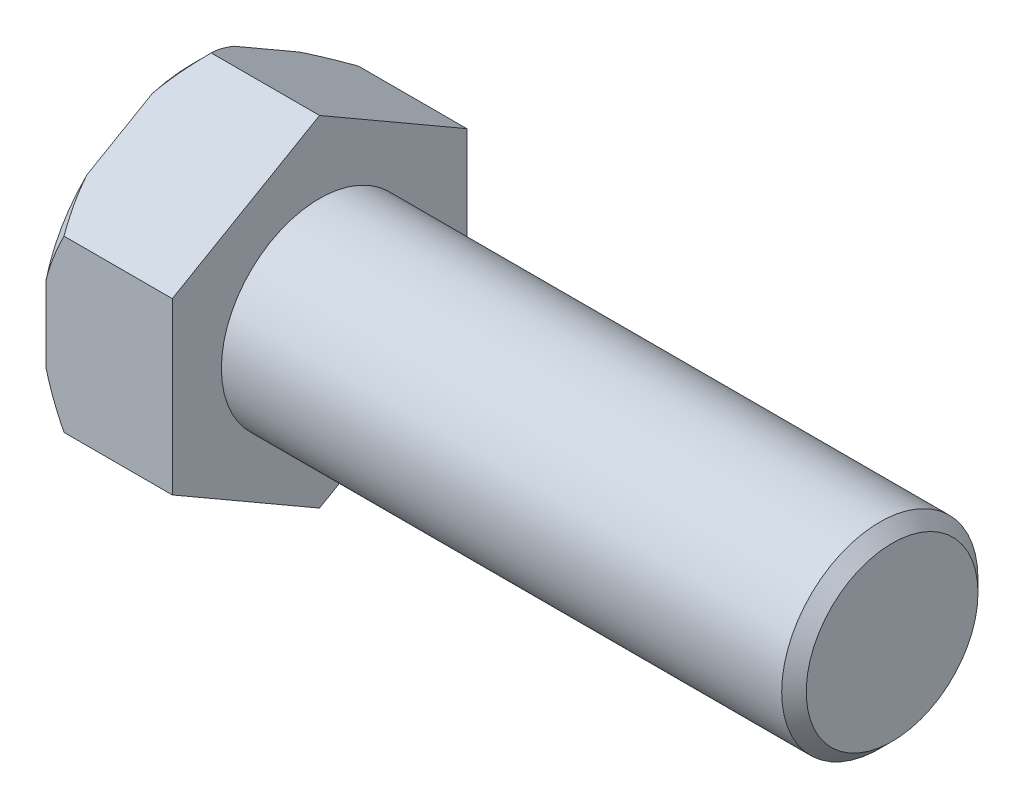
from build123d import *

# Parameters (mm, degrees)
EXTRUDE1_DEPTH     = 15.44
SKETCH3_R          = 12
EXTRUDE2_DEPTH     = 70
CHAMFER1_SIZE      = 1.5
CUT_EXTRUDE1_DEPTH = 0.01


with BuildPart() as part:
    # Sketch1 → Extrude1 (new body)
    with BuildSketch(Plane(origin=(0, 0, 0), x_dir=(0, 0, -1), z_dir=(1, 0, 0))):
        Polygon((0, 20.785), (-18.000338018, 10.3925), (-18.000338018, -10.3925), (0, -20.785), (18.000338018, -10.3925), (18.000338018, 10.3925), align=None)
    extrude(amount=EXTRUDE1_DEPTH)

    # Sketch2 → Cut-Revolve1 (revolve, cut)
    with BuildSketch(Plane.XY):
        Polygon((2.2, 20.785), (0, 18.585), (0, 20.785), align=None)
    revolve(axis=Axis((0, 0, 0), (1, 0, 0)), mode=Mode.SUBTRACT)

    # Sketch3 → Extrude2 (add)
    with BuildSketch(Plane(origin=(15.44, 0, 0), x_dir=(0, 0, -1), z_dir=(1, 0, 0))):
        Circle(SKETCH3_R)
    extrude(amount=EXTRUDE2_DEPTH)

    # Chamfer1
    chamfer1_edges = [part.edges().sort_by_distance(p)[0] for p in [
        (85.44, 0, 12),
    ]]
    chamfer(chamfer1_edges, length=CHAMFER1_SIZE)

    # Sketch4 → Cut-Extrude1 (cut)
    # profile 1 of 3: a face of its own
    with BuildSketch(Plane.ZY):
        with BuildLine():
            add(Edge.make_bspline(
                [(-1.076221955, -3.721907739), (-1.055758707, -3.732577708), (-1.01584854, -3.75338771), (-0.959007677, -3.786895444), (-0.907061247, -3.822210419), (-0.858567989, -3.857664604), (-0.814379881, -3.894615784), (-0.774991015, -3.933210895), (-0.739428429, -3.972486571), (-0.708409298, -4.013107885), (-0.681125843, -4.05496692), (-0.657545746, -4.098173544), (-0.637390601, -4.142633068), (-0.621417074, -4.188830803), (-0.608258651, -4.236088133), (-0.599204647, -4.285015263), (-0.59433542, -4.335289792), (-0.593414839, -4.369267151), (-0.592948718, -4.386471041)],
                knots=[0, 0, 0, 0, 1.272397273, 2.481599622, 3.635517121, 4.734568067, 5.792894095, 6.808321871, 7.773003508, 8.711915296, 9.623354172, 10.525449501, 11.423591555, 12.311487226, 13.218079475, 14.126165749, 15.051214107, 16, 16, 16, 16], degree=3))
            add(Edge.make_bspline(
                [(-0.592948718, -4.386471041), (-0.593499733, -4.41054085), (-0.594590397, -4.458184033), (-0.604090386, -4.528502684), (-0.618313942, -4.596796814), (-0.639085022, -4.66305145), (-0.666023159, -4.726901003), (-0.699220899, -4.788400127), (-0.736800331, -4.848556776), (-0.766980502, -4.885570634), (-0.782251603, -4.904299566)],
                knots=[0, 0, 0, 0, 1.025265484, 2.029385089, 3.018602448, 3.995076438, 4.983346944, 5.966715145, 6.97116228, 8, 8, 8, 8], degree=3))
            add(Edge.make_bspline(
                [(-0.782251603, -4.904299566), (-0.802134798, -4.926152262), (-0.841655488, -4.969587614), (-0.909357579, -5.02598105), (-0.983658925, -5.073373474), (-1.06427202, -5.111996256), (-1.150981378, -5.142057584), (-1.243768524, -5.163659382), (-1.342814347, -5.176032546), (-1.410889684, -5.17782111), (-1.445813301, -5.178738669)],
                knots=[0, 0, 0, 0, 0.954267603, 1.896743057, 2.838368354, 3.796610408, 4.779680527, 5.799409237, 6.871065594, 8, 8, 8, 8], degree=3))
            add(Edge.make_bspline(
                [(-1.445813301, -5.178738669), (-1.479394293, -5.17791547), (-1.544739492, -5.176313609), (-1.639852262, -5.165460444), (-1.728511598, -5.146440539), (-1.811233004, -5.120408676), (-1.887517785, -5.086544227), (-1.957148571, -5.044395363), (-2.02112998, -4.995658619), (-2.077520318, -4.938934277), (-2.127583492, -4.878178654), (-2.171560673, -4.815498933), (-2.208113586, -4.750889392), (-2.239061512, -4.685313415), (-2.262752956, -4.617851877), (-2.279161678, -4.548851867), (-2.289582617, -4.478433908), (-2.290969142, -4.430911299), (-2.291666667, -4.407003893)],
                knots=[0, 0, 0, 0, 1.256902934, 2.445805442, 3.576955095, 4.645999104, 5.686449165, 6.692658513, 7.68621702, 8.689161843, 9.678783111, 10.630372946, 11.551080876, 12.453998257, 13.34127905, 14.221779781, 15.105423033, 16, 16, 16, 16], degree=3))
            add(Edge.make_bspline(
                [(-2.291666667, -4.407003893), (-2.291253895, -4.389461613), (-2.290438111, -4.354791876), (-2.284791791, -4.303570927), (-2.275714318, -4.253716545), (-2.263386135, -4.205044586), (-2.246678259, -4.157909391), (-2.226505307, -4.112087624), (-2.202982484, -4.067527553), (-2.175781651, -4.023985495), (-2.144137349, -3.982071558), (-2.10830617, -3.941074419), (-2.067571978, -3.901630228), (-2.022387936, -3.863257068), (-1.973270408, -3.825274229), (-1.9189436, -3.789734423), (-1.860847695, -3.754121591), (-1.819558119, -3.73282993), (-1.798377404, -3.721907739)],
                knots=[0, 0, 0, 0, 0.941657376, 1.861047343, 2.762797495, 3.66048619, 4.553285746, 5.444104102, 6.34607688, 7.256116206, 8.197091036, 9.162375105, 10.176350973, 11.237807142, 12.343728897, 13.50695164, 14.721116704, 16, 16, 16, 16], degree=3))
            add(Edge.make_bspline(
                [(-1.798377404, -3.721907739), (-1.827371243, -3.70609719), (-1.883511431, -3.675483542), (-1.957846746, -3.619235823), (-2.021697191, -3.558315956), (-2.073307704, -3.491437531), (-2.113930724, -3.420689763), (-2.141801156, -3.346515297), (-2.160655787, -3.270289502), (-2.162523521, -3.218213647), (-2.163461538, -3.192059983)],
                knots=[0, 0, 0, 0, 1.166880483, 2.259407225, 3.286803203, 4.280235371, 5.237608625, 6.161067461, 7.076446754, 8, 8, 8, 8], degree=3))
            add(Edge.make_bspline(
                [(-2.163461538, -3.192059983), (-2.162293378, -3.16541887), (-2.159945173, -3.111865586), (-2.140957087, -3.032146927), (-2.110014182, -2.95384938), (-2.067927756, -2.877352443), (-2.015508316, -2.805245146), (-1.952617926, -2.740573042), (-1.880758428, -2.683921983), (-1.800288523, -2.636367574), (-1.713691212, -2.59766496), (-1.622322838, -2.570966087), (-1.527775342, -2.553511718), (-1.463419829, -2.551535536), (-1.430789263, -2.550533541)],
                knots=[0, 0, 0, 0, 0.888701115, 1.786444228, 2.72001202, 3.692817113, 4.693886446, 5.687152267, 6.695133018, 7.739871481, 8.800368666, 9.853104506, 10.91144658, 12, 12, 12, 12], degree=3))
            add(Edge.make_bspline(
                [(-1.430789263, -2.550533541), (-1.399000824, -2.551566643), (-1.336317643, -2.553603803), (-1.244178623, -2.57059443), (-1.156017996, -2.598972658), (-1.072139783, -2.637470675), (-0.994045592, -2.684889918), (-0.925043942, -2.742319114), (-0.864092098, -2.806705936), (-0.813674674, -2.878791367), (-0.772129752, -2.954994362), (-0.743200537, -3.034724735), (-0.724663413, -3.116259777), (-0.722325296, -3.171429779), (-0.721153846, -3.199071201)],
                knots=[0, 0, 0, 0, 1.072916533, 2.115669174, 3.151510826, 4.193348718, 5.225979165, 6.227137561, 7.216255879, 8.211077061, 9.189680878, 10.138522389, 11.067357538, 12, 12, 12, 12], degree=3))
            add(Edge.make_bspline(
                [(-0.721153846, -3.199071201), (-0.722178532, -3.226197389), (-0.724190958, -3.279471682), (-0.741119486, -3.357133482), (-0.769628996, -3.42986351), (-0.808553398, -3.498487047), (-0.859285889, -3.561759545), (-0.92114927, -3.620485595), (-0.993650325, -3.675147616), (-1.048122387, -3.705995019), (-1.076221955, -3.721907739)],
                knots=[0, 0, 0, 0, 0.975232327, 1.915300861, 2.843280834, 3.77672583, 4.742871857, 5.749627742, 6.839139064, 8, 8, 8, 8], degree=3))
        make_face()
        with BuildLine():
            add(Edge.make_bspline(
                [(-1.443309295, -2.806943797), (-1.460845585, -2.807409112), (-1.495154236, -2.808319471), (-1.545460429, -2.81307564), (-1.593297834, -2.822327938), (-1.639166264, -2.834641303), (-1.682436844, -2.85127558), (-1.72369724, -2.870843444), (-1.762245233, -2.894633491), (-1.798546163, -2.921320061), (-1.831225288, -2.950672137), (-1.860228539, -2.981253364), (-1.884320049, -3.013664359), (-1.904777985, -3.047098901), (-1.919621926, -3.082549313), (-1.930739285, -3.118928725), (-1.938254565, -3.156696856), (-1.938817701, -3.182508649), (-1.939102564, -3.195565592)],
                knots=[0, 0, 0, 0, 1.203892937, 2.355340988, 3.463153438, 4.544400666, 5.610487187, 6.640501085, 7.674077295, 8.714426146, 9.728707835, 10.68524104, 11.601827946, 12.495867327, 13.368432065, 14.231010473, 15.105153427, 16, 16, 16, 16], degree=3))
            add(Edge.make_bspline(
                [(-1.939102564, -3.195565592), (-1.938611588, -3.208623099), (-1.937641348, -3.234426608), (-1.930137685, -3.272530798), (-1.918954217, -3.309974824), (-1.901346602, -3.345868332), (-1.880227775, -3.381456446), (-1.854162435, -3.415849721), (-1.823098843, -3.449167854), (-1.788079243, -3.481127454), (-1.749928145, -3.511055142), (-1.709510971, -3.537035986), (-1.667334977, -3.558774637), (-1.623833499, -3.576867069), (-1.578563179, -3.59093131), (-1.531801413, -3.600908914), (-1.48354034, -3.60711034), (-1.450839925, -3.60785107), (-1.434294872, -3.608225848)],
                knots=[0, 0, 0, 0, 0.873023192, 1.725219244, 2.590779336, 3.480155217, 4.391973325, 5.357036234, 6.360879153, 7.436073238, 8.526419356, 9.601555421, 10.645666583, 11.697338044, 12.750135903, 13.812665442, 14.89329948, 16, 16, 16, 16], degree=3))
            add(Edge.make_bspline(
                [(-1.434294872, -3.608225848), (-1.413044798, -3.607602372), (-1.370754535, -3.606361577), (-1.308412155, -3.594825024), (-1.247795981, -3.57667794), (-1.189553906, -3.551849393), (-1.135193488, -3.520686636), (-1.086736297, -3.483377337), (-1.044595659, -3.440782982), (-1.009209509, -3.393566671), (-0.981773904, -3.343315536), (-0.96041547, -3.292886755), (-0.947943173, -3.241742305), (-0.94631634, -3.207480188), (-0.945512821, -3.190557579)],
                knots=[0, 0, 0, 0, 1.076279235, 2.141928126, 3.20205304, 4.278698113, 5.344010996, 6.36967002, 7.368914609, 8.37248503, 9.349703398, 10.264243087, 11.142681841, 12, 12, 12, 12], degree=3))
            add(Edge.make_bspline(
                [(-0.945512821, -3.190557579), (-0.945892747, -3.178680411), (-0.946646848, -3.155105933), (-0.952861173, -3.120292815), (-0.963129626, -3.086271684), (-0.977031826, -3.052761491), (-0.995324536, -3.020232397), (-1.017013241, -2.988173048), (-1.043359314, -2.957304645), (-1.072928195, -2.926907825), (-1.10646063, -2.898776379), (-1.143891996, -2.874037301), (-1.185030389, -2.853028475), (-1.229876782, -2.835965078), (-1.278266013, -2.823149114), (-1.329975209, -2.813551723), (-1.385435528, -2.808142358), (-1.423599636, -2.807351982), (-1.443309295, -2.806943797)],
                knots=[0, 0, 0, 0, 0.814439003, 1.616544685, 2.417341072, 3.248991801, 4.09997495, 4.973547432, 5.9003056, 6.880240646, 7.880314356, 8.896779544, 9.951930927, 11.043077905, 12.18215768, 13.381699519, 14.647792085, 16, 16, 16, 16], degree=3))
        make_face(mode=Mode.SUBTRACT)
        with BuildLine():
            add(Edge.make_bspline(
                [(-1.428786058, -3.864636105), (-1.451018762, -3.865031563), (-1.494633902, -3.865807355), (-1.558531708, -3.874442713), (-1.619855397, -3.886463708), (-1.678398209, -3.904700021), (-1.734135421, -3.9284118), (-1.787368766, -3.956936471), (-1.837691001, -3.990654645), (-1.884407234, -4.029137941), (-1.927066755, -4.07060898), (-1.964494113, -4.114510505), (-1.996278056, -4.1600266), (-2.021873235, -4.207735335), (-2.042881615, -4.256626486), (-2.056677242, -4.307917625), (-2.065521321, -4.360622706), (-2.066708915, -4.396451348), (-2.067307692, -4.414515912)],
                knots=[0, 0, 0, 0, 1.140299081, 2.23698856, 3.303958914, 4.344563908, 5.37730929, 6.408454204, 7.439741482, 8.480804886, 9.510774543, 10.48932336, 11.43758569, 12.353841022, 13.263987381, 14.161954604, 15.073269652, 16, 16, 16, 16], degree=3))
            add(Edge.make_bspline(
                [(-2.067307692, -4.414515912), (-2.066333936, -4.43696656), (-2.064402026, -4.481508119), (-2.049075856, -4.547338884), (-2.024479045, -4.611068209), (-1.990175319, -4.672176747), (-1.947698481, -4.729283966), (-1.89546529, -4.779061663), (-1.836721835, -4.82329129), (-1.76948051, -4.8590631), (-1.696031606, -4.887630853), (-1.616394657, -4.907313684), (-1.531712572, -4.920343291), (-1.473241435, -4.921656277), (-1.443309295, -4.922328412)],
                knots=[0, 0, 0, 0, 0.898778495, 1.783155532, 2.693654817, 3.627872908, 4.583023416, 5.533784346, 6.509005473, 7.520592997, 8.575161974, 9.658835044, 10.801527049, 12, 12, 12, 12], degree=3))
            add(Edge.make_bspline(
                [(-1.443309295, -4.922328412), (-1.419916175, -4.921879263), (-1.374338876, -4.921004177), (-1.307848912, -4.913279682), (-1.245102806, -4.90102995), (-1.186222236, -4.883213131), (-1.130548064, -4.861463148), (-1.07902424, -4.83348309), (-1.030325292, -4.801660002), (-0.986850919, -4.763904176), (-0.94725577, -4.723561679), (-0.912731989, -4.680854506), (-0.88276231, -4.63694334), (-0.859240199, -4.590835851), (-0.840435732, -4.543416626), (-0.826918907, -4.494248404), (-0.818578753, -4.44318038), (-0.817735256, -4.408538187), (-0.817307692, -4.390978252)],
                knots=[0, 0, 0, 0, 1.224942928, 2.386581632, 3.501229538, 4.569074225, 5.605009692, 6.626002462, 7.634866581, 8.645888296, 9.63523824, 10.59253846, 11.518950513, 12.414518923, 13.29783783, 14.186679152, 15.080837789, 16, 16, 16, 16], degree=3))
            add(Edge.make_bspline(
                [(-0.817307692, -4.390978252), (-0.817954727, -4.373923009), (-0.819230566, -4.340293048), (-0.827328203, -4.290459815), (-0.84155383, -4.242314948), (-0.861073399, -4.195279229), (-0.887059801, -4.150305693), (-0.917663279, -4.106222713), (-0.95458765, -4.064253824), (-0.996310933, -4.024073042), (-1.041781619, -3.986918944), (-1.090115294, -3.954051488), (-1.140939909, -3.926371405), (-1.194147917, -3.903859622), (-1.249621172, -3.886154287), (-1.30731887, -3.873785719), (-1.367308567, -3.866000288), (-1.408062046, -3.86509597), (-1.428786058, -3.864636105)],
                knots=[0, 0, 0, 0, 0.917430815, 1.809013306, 2.70690318, 3.612392954, 4.541220862, 5.495268465, 6.494511384, 7.542276156, 8.608045339, 9.649016899, 10.681629292, 11.715607085, 12.752076957, 13.808767841, 14.885711793, 16, 16, 16, 16], degree=3))
        make_face(mode=Mode.SUBTRACT)
    # profile 2 of 3: a face of its own
    with BuildSketch(Plane.ZY):
        with BuildLine():
            add(Edge.make_bspline(
                [(0.032051282, -4.73002072), (0.045972862, -4.730847982), (0.073264492, -4.732469732), (0.112721013, -4.743595928), (0.148431484, -4.763352114), (0.18024023, -4.78968267), (0.206459142, -4.821608143), (0.226919394, -4.857033793), (0.237948669, -4.896820644), (0.239558606, -4.924270412), (0.240384615, -4.938354053)],
                knots=[0, 0, 0, 0, 1.020151414, 1.999887582, 2.974338812, 3.990962822, 5.007586832, 5.987933904, 6.967670073, 8, 8, 8, 8], degree=3))
            add(Edge.make_bspline(
                [(0.240384615, -4.938354053), (0.239530615, -4.952099289), (0.237846538, -4.979204692), (0.226944675, -5.018691451), (0.206303211, -5.054139239), (0.180421073, -5.08649791), (0.148423621, -5.112884246), (0.112636587, -5.132472349), (0.073357117, -5.144395192), (0.045988315, -5.145913976), (0.032051282, -5.146687387)],
                knots=[0, 0, 0, 0, 1.009421747, 1.99056486, 2.972319754, 3.999869655, 5.017953583, 5.993804169, 6.978383603, 8, 8, 8, 8], degree=3))
            add(Edge.make_bspline(
                [(0.032051282, -5.146687387), (0.018104207, -5.14594196), (-0.009124138, -5.144486692), (-0.048256991, -5.132227545), (-0.084261969, -5.11306793), (-0.116253191, -5.086448709), (-0.1423521, -5.05430575), (-0.162084516, -5.018447324), (-0.173934622, -4.979317726), (-0.175493103, -4.952121552), (-0.176282051, -4.938354053)],
                knots=[0, 0, 0, 0, 1.022052826, 1.995314843, 2.982371812, 4.00089066, 5.028879526, 6.005146991, 6.990147033, 8, 8, 8, 8], degree=3))
            add(Edge.make_bspline(
                [(-0.176282051, -4.938354053), (-0.175523409, -4.924247354), (-0.174042253, -4.896705754), (-0.162059638, -4.85727782), (-0.142505201, -4.82144322), (-0.116072776, -4.789731377), (-0.084269708, -4.763169018), (-0.048343847, -4.743837023), (-0.00902989, -4.732379586), (0.018120066, -4.730820645), (0.032051282, -4.73002072)],
                knots=[0, 0, 0, 0, 1.032775665, 2.016367738, 2.991239715, 4.008302682, 5.025365648, 6.011011707, 6.979408107, 8, 8, 8, 8], degree=3))
        make_face()
    # profile 3 of 3: a face of its own
    with BuildSketch(Plane.ZY):
        with BuildLine():
            add(Edge.make_bspline(
                [(1.776342147, -3.721907739), (1.796805395, -3.732577708), (1.836715563, -3.75338771), (1.893556426, -3.786895444), (1.945502855, -3.822210419), (1.993996114, -3.857664604), (2.038184222, -3.894615784), (2.077573088, -3.933210895), (2.113135674, -3.972486571), (2.144154805, -4.013107885), (2.17143826, -4.05496692), (2.195018356, -4.098173544), (2.215173501, -4.142633068), (2.231147029, -4.188830803), (2.244305452, -4.236088133), (2.253359455, -4.285015263), (2.258228682, -4.335289792), (2.259149263, -4.369267151), (2.259615385, -4.386471041)],
                knots=[0, 0, 0, 0, 1.272397273, 2.481599622, 3.635517121, 4.734568067, 5.792894095, 6.808321871, 7.773003508, 8.711915296, 9.623354172, 10.525449501, 11.423591555, 12.311487226, 13.218079475, 14.126165749, 15.051214107, 16, 16, 16, 16], degree=3))
            add(Edge.make_bspline(
                [(2.259615385, -4.386471041), (2.25906437, -4.41054085), (2.257973705, -4.458184033), (2.248473717, -4.528502684), (2.234250161, -4.596796814), (2.21347908, -4.66305145), (2.186540944, -4.726901003), (2.153343204, -4.788400127), (2.115763772, -4.848556776), (2.085583601, -4.885570634), (2.0703125, -4.904299566)],
                knots=[0, 0, 0, 0, 1.025265484, 2.029385089, 3.018602448, 3.995076438, 4.983346944, 5.966715145, 6.97116228, 8, 8, 8, 8], degree=3))
            add(Edge.make_bspline(
                [(2.0703125, -4.904299566), (2.050429304, -4.926152262), (2.010908614, -4.969587614), (1.943206523, -5.02598105), (1.868905178, -5.073373474), (1.788292083, -5.111996256), (1.701582725, -5.142057584), (1.608795579, -5.163659382), (1.509749755, -5.176032546), (1.441674419, -5.17782111), (1.406750801, -5.178738669)],
                knots=[0, 0, 0, 0, 0.954267603, 1.896743057, 2.838368354, 3.796610408, 4.779680527, 5.799409237, 6.871065594, 8, 8, 8, 8], degree=3))
            add(Edge.make_bspline(
                [(1.406750801, -5.178738669), (1.373169809, -5.17791547), (1.30782461, -5.176313609), (1.21271184, -5.165460444), (1.124052505, -5.146440539), (1.041331099, -5.120408676), (0.965046318, -5.086544227), (0.895415531, -5.044395363), (0.831434123, -4.995658619), (0.775043784, -4.938934277), (0.72498061, -4.878178654), (0.681003429, -4.815498933), (0.644450516, -4.750889392), (0.613502591, -4.685313415), (0.589811146, -4.617851877), (0.573402425, -4.548851867), (0.562981486, -4.478433908), (0.561594961, -4.430911299), (0.560897436, -4.407003893)],
                knots=[0, 0, 0, 0, 1.256902934, 2.445805442, 3.576955095, 4.645999104, 5.686449165, 6.692658513, 7.68621702, 8.689161843, 9.678783111, 10.630372946, 11.551080876, 12.453998257, 13.34127905, 14.221779781, 15.105423033, 16, 16, 16, 16], degree=3))
            add(Edge.make_bspline(
                [(0.560897436, -4.407003893), (0.561310208, -4.389461613), (0.562125992, -4.354791876), (0.567772312, -4.303570927), (0.576849784, -4.253716545), (0.589177967, -4.205044586), (0.605885844, -4.157909391), (0.626058796, -4.112087624), (0.649581619, -4.067527553), (0.676782451, -4.023985495), (0.708426754, -3.982071558), (0.744257932, -3.941074419), (0.784992124, -3.901630228), (0.830176166, -3.863257068), (0.879293695, -3.825274229), (0.933620502, -3.789734423), (0.991716408, -3.754121591), (1.033005983, -3.73282993), (1.054186699, -3.721907739)],
                knots=[0, 0, 0, 0, 0.941657376, 1.861047343, 2.762797495, 3.66048619, 4.553285746, 5.444104102, 6.34607688, 7.256116206, 8.197091036, 9.162375105, 10.176350973, 11.237807142, 12.343728897, 13.50695164, 14.721116704, 16, 16, 16, 16], degree=3))
            add(Edge.make_bspline(
                [(1.054186699, -3.721907739), (1.02519286, -3.70609719), (0.969052672, -3.675483542), (0.894717357, -3.619235823), (0.830866911, -3.558315956), (0.779256399, -3.491437531), (0.738633379, -3.420689763), (0.710762947, -3.346515297), (0.691908316, -3.270289502), (0.690040582, -3.218213647), (0.689102564, -3.192059983)],
                knots=[0, 0, 0, 0, 1.166880483, 2.259407225, 3.286803203, 4.280235371, 5.237608625, 6.161067461, 7.076446754, 8, 8, 8, 8], degree=3))
            add(Edge.make_bspline(
                [(0.689102564, -3.192059983), (0.690270724, -3.16541887), (0.69261893, -3.111865586), (0.711607016, -3.032146927), (0.74254992, -2.95384938), (0.784636347, -2.877352443), (0.837055787, -2.805245146), (0.899946177, -2.740573042), (0.971805675, -2.683921983), (1.05227558, -2.636367574), (1.138872891, -2.59766496), (1.230241265, -2.570966087), (1.32478876, -2.553511718), (1.389144274, -2.551535536), (1.42177484, -2.550533541)],
                knots=[0, 0, 0, 0, 0.888701115, 1.786444228, 2.72001202, 3.692817113, 4.693886446, 5.687152267, 6.695133018, 7.739871481, 8.800368666, 9.853104506, 10.91144658, 12, 12, 12, 12], degree=3))
            add(Edge.make_bspline(
                [(1.42177484, -2.550533541), (1.453563279, -2.551566643), (1.51624646, -2.553603803), (1.60838548, -2.57059443), (1.696546106, -2.598972658), (1.78042432, -2.637470675), (1.858518511, -2.684889918), (1.92752016, -2.742319114), (1.988472005, -2.806705936), (2.038889429, -2.878791367), (2.08043435, -2.954994362), (2.109363565, -3.034724735), (2.127900689, -3.116259777), (2.130238807, -3.171429779), (2.131410256, -3.199071201)],
                knots=[0, 0, 0, 0, 1.072916533, 2.115669174, 3.151510826, 4.193348718, 5.225979165, 6.227137561, 7.216255879, 8.211077061, 9.189680878, 10.138522389, 11.067357538, 12, 12, 12, 12], degree=3))
            add(Edge.make_bspline(
                [(2.131410256, -3.199071201), (2.13038557, -3.226197389), (2.128373145, -3.279471682), (2.111444617, -3.357133482), (2.082935107, -3.42986351), (2.044010705, -3.498487047), (1.993278214, -3.561759545), (1.931414833, -3.620485595), (1.858913777, -3.675147616), (1.804441715, -3.705995019), (1.776342147, -3.721907739)],
                knots=[0, 0, 0, 0, 0.975232327, 1.915300861, 2.843280834, 3.77672583, 4.742871857, 5.749627742, 6.839139064, 8, 8, 8, 8], degree=3))
        make_face()
        with BuildLine():
            add(Edge.make_bspline(
                [(1.409254808, -2.806943797), (1.391718518, -2.807409112), (1.357409867, -2.808319471), (1.307103673, -2.81307564), (1.259266268, -2.822327938), (1.213397839, -2.834641303), (1.170127259, -2.85127558), (1.128866863, -2.870843444), (1.09031887, -2.894633491), (1.054017939, -2.921320061), (1.021338815, -2.950672137), (0.992335564, -2.981253364), (0.968244053, -3.013664359), (0.947786118, -3.047098901), (0.932942177, -3.082549313), (0.921824817, -3.118928725), (0.914309537, -3.156696856), (0.913746402, -3.182508649), (0.913461538, -3.195565592)],
                knots=[0, 0, 0, 0, 1.203892937, 2.355340988, 3.463153438, 4.544400666, 5.610487187, 6.640501085, 7.674077295, 8.714426146, 9.728707835, 10.68524104, 11.601827946, 12.495867327, 13.368432065, 14.231010473, 15.105153427, 16, 16, 16, 16], degree=3))
            add(Edge.make_bspline(
                [(0.913461538, -3.195565592), (0.913952515, -3.208623099), (0.914922755, -3.234426608), (0.922426418, -3.272530798), (0.933609885, -3.309974824), (0.951217501, -3.345868332), (0.972336328, -3.381456446), (0.998401668, -3.415849721), (1.029465259, -3.449167854), (1.06448486, -3.481127454), (1.102635958, -3.511055142), (1.143053132, -3.537035986), (1.185229126, -3.558774637), (1.228730604, -3.576867069), (1.274000923, -3.59093131), (1.32076269, -3.600908914), (1.369023763, -3.60711034), (1.401724178, -3.60785107), (1.418269231, -3.608225848)],
                knots=[0, 0, 0, 0, 0.873023192, 1.725219244, 2.590779336, 3.480155217, 4.391973325, 5.357036234, 6.360879153, 7.436073238, 8.526419356, 9.601555421, 10.645666583, 11.697338044, 12.750135903, 13.812665442, 14.89329948, 16, 16, 16, 16], degree=3))
            add(Edge.make_bspline(
                [(1.418269231, -3.608225848), (1.439519305, -3.607602372), (1.481809568, -3.606361577), (1.544151947, -3.594825024), (1.604768122, -3.57667794), (1.663010196, -3.551849393), (1.717370614, -3.520686636), (1.765827806, -3.483377337), (1.807968444, -3.440782982), (1.843354594, -3.393566671), (1.870790198, -3.343315536), (1.892148633, -3.292886755), (1.904620929, -3.241742305), (1.906247763, -3.207480188), (1.907051282, -3.190557579)],
                knots=[0, 0, 0, 0, 1.076279235, 2.141928126, 3.20205304, 4.278698113, 5.344010996, 6.36967002, 7.368914609, 8.37248503, 9.349703398, 10.264243087, 11.142681841, 12, 12, 12, 12], degree=3))
            add(Edge.make_bspline(
                [(1.907051282, -3.190557579), (1.906671355, -3.178680411), (1.905917255, -3.155105933), (1.899702929, -3.120292815), (1.889434477, -3.086271684), (1.875532277, -3.052761491), (1.857239566, -3.020232397), (1.835550861, -2.988173048), (1.809204789, -2.957304645), (1.779635908, -2.926907825), (1.746103473, -2.898776379), (1.708672107, -2.874037301), (1.667533714, -2.853028475), (1.622687321, -2.835965078), (1.57429809, -2.823149114), (1.522588894, -2.813551723), (1.467128574, -2.808142358), (1.428964466, -2.807351982), (1.409254808, -2.806943797)],
                knots=[0, 0, 0, 0, 0.814439003, 1.616544685, 2.417341072, 3.248991801, 4.09997495, 4.973547432, 5.9003056, 6.880240646, 7.880314356, 8.896779544, 9.951930927, 11.043077905, 12.18215768, 13.381699519, 14.647792085, 16, 16, 16, 16], degree=3))
        make_face(mode=Mode.SUBTRACT)
        with BuildLine():
            add(Edge.make_bspline(
                [(1.423778045, -3.864636105), (1.401545341, -3.865031563), (1.357930201, -3.865807355), (1.294032395, -3.874442713), (1.232708705, -3.886463708), (1.174165893, -3.904700021), (1.118428681, -3.9284118), (1.065195337, -3.956936471), (1.014873101, -3.990654645), (0.968156868, -4.029137941), (0.925497347, -4.07060898), (0.88806999, -4.114510505), (0.856286047, -4.1600266), (0.830690868, -4.207735335), (0.809682488, -4.256626486), (0.795886861, -4.307917625), (0.787042781, -4.360622706), (0.785855187, -4.396451348), (0.78525641, -4.414515912)],
                knots=[0, 0, 0, 0, 1.140299081, 2.23698856, 3.303958914, 4.344563908, 5.37730929, 6.408454204, 7.439741482, 8.480804886, 9.510774543, 10.48932336, 11.43758569, 12.353841022, 13.263987381, 14.161954604, 15.073269652, 16, 16, 16, 16], degree=3))
            add(Edge.make_bspline(
                [(0.78525641, -4.414515912), (0.786230167, -4.43696656), (0.788162076, -4.481508119), (0.803488247, -4.547338884), (0.828085058, -4.611068209), (0.862388784, -4.672176747), (0.904865621, -4.729283966), (0.957098812, -4.779061663), (1.015842268, -4.82329129), (1.083083592, -4.8590631), (1.156532497, -4.887630853), (1.236169446, -4.907313684), (1.320851531, -4.920343291), (1.379322668, -4.921656277), (1.409254808, -4.922328412)],
                knots=[0, 0, 0, 0, 0.898778495, 1.783155532, 2.693654817, 3.627872908, 4.583023416, 5.533784346, 6.509005473, 7.520592997, 8.575161974, 9.658835044, 10.801527049, 12, 12, 12, 12], degree=3))
            add(Edge.make_bspline(
                [(1.409254808, -4.922328412), (1.432647928, -4.921879263), (1.478225227, -4.921004177), (1.54471519, -4.913279682), (1.607461297, -4.90102995), (1.666341867, -4.883213131), (1.722016038, -4.861463148), (1.773539862, -4.83348309), (1.82223881, -4.801660002), (1.865713184, -4.763904176), (1.905308333, -4.723561679), (1.939832113, -4.680854506), (1.969801793, -4.63694334), (1.993323904, -4.590835851), (2.012128371, -4.543416626), (2.025645196, -4.494248404), (2.033985349, -4.44318038), (2.034828846, -4.408538187), (2.03525641, -4.390978252)],
                knots=[0, 0, 0, 0, 1.224942928, 2.386581632, 3.501229538, 4.569074225, 5.605009692, 6.626002462, 7.634866581, 8.645888296, 9.63523824, 10.59253846, 11.518950513, 12.414518923, 13.29783783, 14.186679152, 15.080837789, 16, 16, 16, 16], degree=3))
            add(Edge.make_bspline(
                [(2.03525641, -4.390978252), (2.034609376, -4.373923009), (2.033333536, -4.340293048), (2.0252359, -4.290459815), (2.011010273, -4.242314948), (1.991490704, -4.195279229), (1.965504302, -4.150305693), (1.934900823, -4.106222713), (1.897976453, -4.064253824), (1.85625317, -4.024073042), (1.810782484, -3.986918944), (1.762448809, -3.954051488), (1.711624193, -3.926371405), (1.658416185, -3.903859622), (1.602942931, -3.886154287), (1.545245232, -3.873785719), (1.485255536, -3.866000288), (1.444502057, -3.86509597), (1.423778045, -3.864636105)],
                knots=[0, 0, 0, 0, 0.917430815, 1.809013306, 2.70690318, 3.612392954, 4.541220862, 5.495268465, 6.494511384, 7.542276156, 8.608045339, 9.649016899, 10.681629292, 11.715607085, 12.752076957, 13.808767841, 14.885711793, 16, 16, 16, 16], degree=3))
        make_face(mode=Mode.SUBTRACT)
    extrude(amount=-CUT_EXTRUDE1_DEPTH, mode=Mode.SUBTRACT)


solid = part.part
